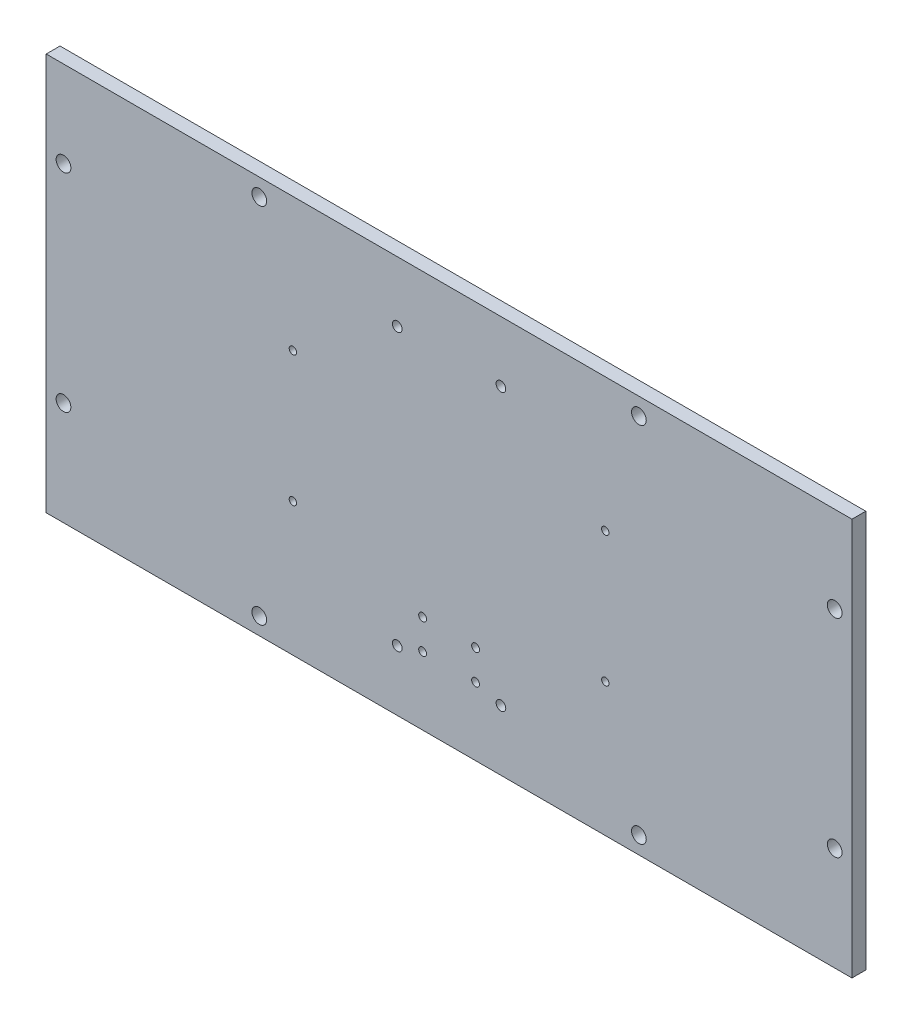
from build123d import *

# Parameters (mm, degrees)
SKETCH2_W           = 349.8
SKETCH2_H           = 172.5
SKETCH2_R           = 3.2
SKETCH2_R_2         = 1.6
SKETCH2_R_3         = 2.1
SKETCH2_R_4         = 1.7
BOSS_EXTRUDE1_DEPTH = 6


with BuildPart() as part:
    # Sketch2 → Boss-Extrude1 (new body)
    with BuildSketch(Plane.XY):
        with Locations((0, -3.75)):
            Rectangle(SKETCH2_W, SKETCH2_H)
        with Locations((-82.4, 75)):
            Circle(SKETCH2_R, mode=Mode.SUBTRACT)
        with Locations((82.4, 75)):
            Circle(SKETCH2_R, mode=Mode.SUBTRACT)
        with Locations((-67.818, 24.571)):
            Circle(SKETCH2_R_2, mode=Mode.SUBTRACT)
        with Locations((-167.4, -45)):
            Circle(SKETCH2_R, mode=Mode.SUBTRACT)
        with Locations((167.4, -45)):
            Circle(SKETCH2_R, mode=Mode.SUBTRACT)
        with Locations((22.5, -63.75)):
            Circle(SKETCH2_R_3, mode=Mode.SUBTRACT)
        with Locations((22.5, 56.25)):
            Circle(SKETCH2_R_3, mode=Mode.SUBTRACT)
        with Locations((-67.818, -32.071)):
            Circle(SKETCH2_R_2, mode=Mode.SUBTRACT)
        with Locations((67.818, -32.071)):
            Circle(SKETCH2_R_2, mode=Mode.SUBTRACT)
        with Locations((67.818, 24.571)):
            Circle(SKETCH2_R_2, mode=Mode.SUBTRACT)
        with Locations((-22.5, 56.25)):
            Circle(SKETCH2_R_3, mode=Mode.SUBTRACT)
        with Locations((-22.5, -63.75)):
            Circle(SKETCH2_R_3, mode=Mode.SUBTRACT)
        with Locations((-11.5, -47.5)):
            Circle(SKETCH2_R_4, mode=Mode.SUBTRACT)
        with Locations((11.5, -47.5)):
            Circle(SKETCH2_R_4, mode=Mode.SUBTRACT)
        with Locations((-167.4, 45)):
            Circle(SKETCH2_R, mode=Mode.SUBTRACT)
        with Locations((167.4, 45)):
            Circle(SKETCH2_R, mode=Mode.SUBTRACT)
        with Locations((-11.5, -60.5)):
            Circle(SKETCH2_R_4, mode=Mode.SUBTRACT)
        with Locations((11.5, -60.5)):
            Circle(SKETCH2_R_4, mode=Mode.SUBTRACT)
        with Locations((-82.4, -82.5)):
            Circle(SKETCH2_R, mode=Mode.SUBTRACT)
        with Locations((82.4, -82.5)):
            Circle(SKETCH2_R, mode=Mode.SUBTRACT)
    extrude(amount=BOSS_EXTRUDE1_DEPTH)


solid = part.part
